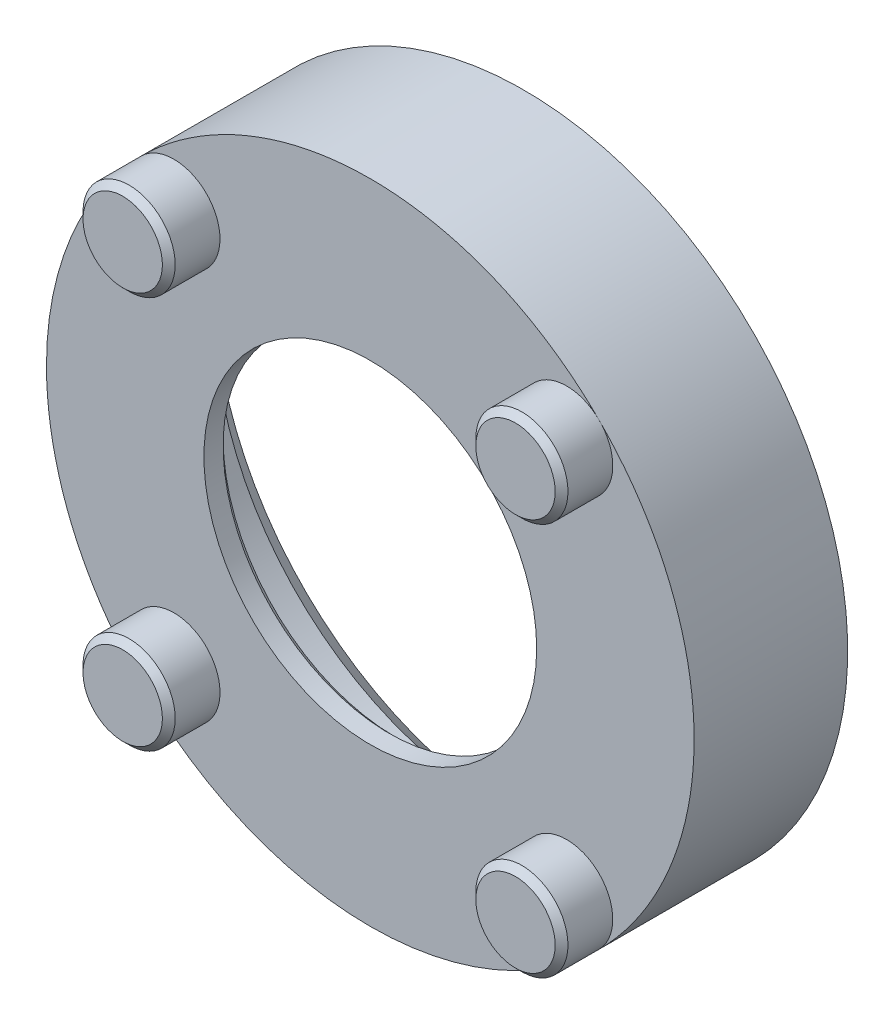
from build123d import *

# Parameters (mm, degrees)
SKETCH1_R           = 12.6
SKETCH1_R_2         = 11.1
BOSS_EXTRUDE1_DEPTH = 5
CHAMFER1_SIZE       = 1
SKETCH2_R           = 1.8
BOSS_EXTRUDE2_DEPTH = 3
BOSS_EXTRUDE3_START = 1
SKETCH3_R           = 12.6
BOSS_EXTRUDE3_DEPTH = 1
SKETCH5_R           = 6.5
CUT_EXTRUDE1_DEPTH  = 19.507295859
CHAMFER2_SIZE       = 0.25
CHAMFER3_SIZE       = 0.25
BOSS_EXTRUDE4_START = -6
SKETCH7_R           = 12.65
SKETCH7_R_2         = 12.6
BOSS_EXTRUDE4_DEPTH = 6


with BuildPart() as part:
    # Sketch1 → Boss-Extrude1 (new body)
    with BuildSketch(Plane.XY):
        Circle(SKETCH1_R)
        Circle(SKETCH1_R_2, mode=Mode.SUBTRACT)
    extrude(amount=-BOSS_EXTRUDE1_DEPTH)

    # Chamfer1
    chamfer1_edges = [part.edges().sort_by_distance(p)[0] for p in [
        (-11.1, 0, -5),
    ]]
    chamfer(chamfer1_edges, length=CHAMFER1_SIZE)

    # Sketch2 → Boss-Extrude2 (add)
    with BuildSketch(Plane.XY):
        with Locations(Location((7.672108576, -7.672108576, 0), (0, 0, 228.298602852))):
            Circle(SKETCH2_R)
        with Locations(Location((-7.672108576, -7.672108576, 0), (0, 0, 210.392900991))):
            Circle(SKETCH2_R)
        with Locations(Location((-7.672108576, 7.672108576, 0), (0, 0, 149.607099009))):
            Circle(SKETCH2_R)
        with Locations(Location((7.672108576, 7.672108576, 0), (0, 0, 131.701397148))):
            Circle(SKETCH2_R)
    extrude(amount=BOSS_EXTRUDE2_DEPTH)

    # Sketch3 → Boss-Extrude3 (add)
    with BuildSketch(Plane.XY.offset(BOSS_EXTRUDE3_START)):
        Circle(SKETCH3_R)
    extrude(amount=-BOSS_EXTRUDE3_DEPTH)

    # Sketch5 → Cut-Extrude1 (cut, through all)
    with BuildSketch(Plane.XY):
        Circle(SKETCH5_R)
    extrude(amount=CUT_EXTRUDE1_DEPTH, mode=Mode.SUBTRACT)

    # Chamfer2
    chamfer2_edges = [part.edges().sort_by_distance(p)[0] for p in [
        (8.869555986, -6.328189047, 3),
        (-6.119471127, -6.761440167, 3),
        (-6.119471127, 6.761440167, 3),
        (8.869555986, 6.328189047, 3),
    ]]
    chamfer(chamfer2_edges, length=CHAMFER2_SIZE)

    # Chamfer3
    chamfer3_edges = [part.edges().sort_by_distance(p)[0] for p in [
        (-6.5, 0, 0),
    ]]
    chamfer(chamfer3_edges, length=CHAMFER3_SIZE)

    # Sketch7 → Boss-Extrude4 (add)
    with BuildSketch(Plane(origin=(0, 0, -5), x_dir=(-1, 0, 0), z_dir=(0, 0, -1)).offset(BOSS_EXTRUDE4_START)):
        Circle(SKETCH7_R)
        Circle(SKETCH7_R_2, mode=Mode.SUBTRACT)
    extrude(amount=BOSS_EXTRUDE4_DEPTH)


solid = part.part
